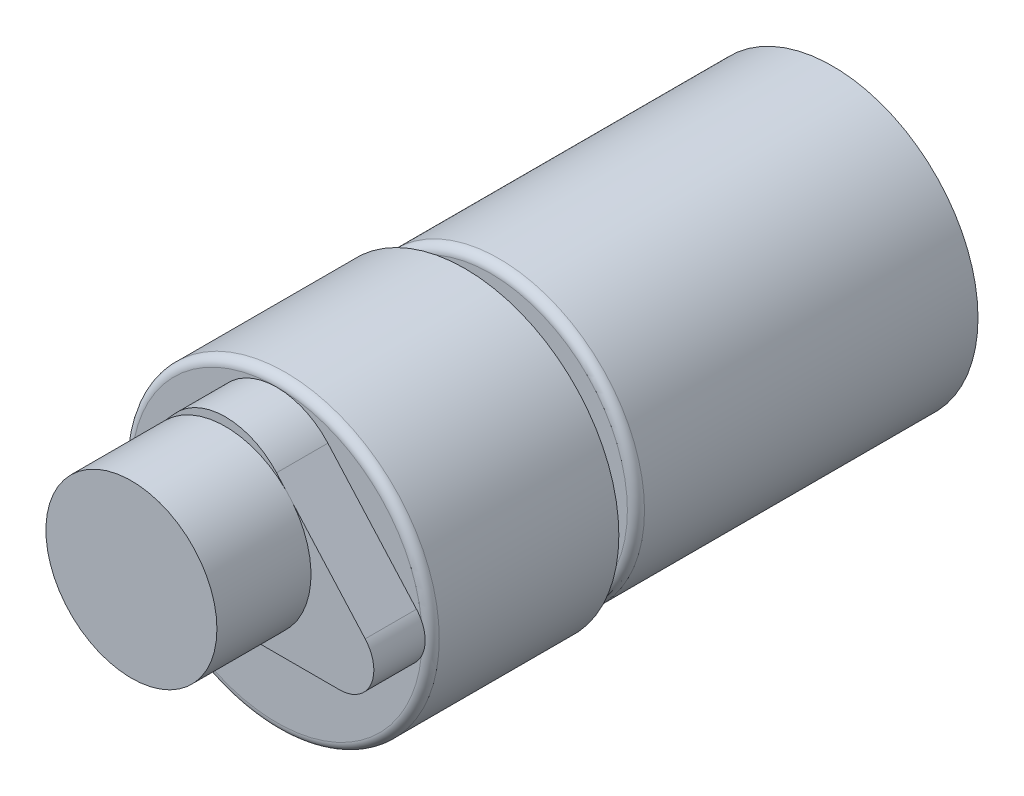
from build123d import *

# Parameters (mm, degrees)
ESQUISSE1_R        = 17
BOSS_EXTRU_1_DEPTH = 40
ESQUISSE2_R        = 5
BOSS_EXTRU_2_DEPTH = 3
CONG_1_R           = 1
ESQUISSE3_R        = 18
BOSS_EXTRU_3_DEPTH = 22
CONG_2_R           = 1
BOSS_EXTRU_4_DEPTH = 6
ESQUISSE5_R        = 10
BOSS_EXTRU_5_DEPTH = 11


with BuildPart() as part:
    # Esquisse1 → Boss.-Extru.1 (new body)
    with BuildSketch(Plane.XY):
        Circle(ESQUISSE1_R)
    extrude(amount=BOSS_EXTRU_1_DEPTH)

    # Esquisse2 → Boss.-Extru.2 (add)
    with BuildSketch(Plane.XY.offset(40)):
        Circle(ESQUISSE2_R)
    extrude(amount=BOSS_EXTRU_2_DEPTH)

    # Congé1
    cong_1_edges = [part.edges().sort_by_distance(p)[0] for p in [
        (-17, 0, 40),
    ]]
    fillet(cong_1_edges, radius=CONG_1_R)

    # Esquisse3 → Boss.-Extru.3 (add)
    with BuildSketch(Plane.XY.offset(43)):
        Circle(ESQUISSE3_R)
    extrude(amount=BOSS_EXTRU_3_DEPTH)

    # Congé2
    cong_2_edges = [part.edges().sort_by_distance(p)[0] for p in [
        (-18, 0, 65),
    ]]
    fillet(cong_2_edges, radius=CONG_2_R)

    # Esquisse4 → Boss.-Extru.4 (add)
    with BuildSketch(Plane.XY.offset(65)):
        with BuildLine():
            Line((-13.350159933, -4), (13.350159933, -4))
            ThreePointArc((13.350159933, -4), (17, -1.636663523), (16.336939985, 2.660666256))
            Line((16.336939985, 2.660666256), (5.973560103, 14.294269767))
            ThreePointArc((5.973560103, 14.294269767), (0, 16.972937256), (-5.973560103, 14.294269767))
            Line((-5.973560103, 14.294269767), (-16.336939985, 2.660666256))
            ThreePointArc((-16.336939985, 2.660666256), (-17, -1.636663523), (-13.350159933, -4))
        make_face()
    extrude(amount=BOSS_EXTRU_4_DEPTH)

    # Esquisse5 → Boss.-Extru.5 (add)
    with BuildSketch(Plane.XY.offset(71)):
        with Locations(Location((0, 6, 0), (0, 0, 142.149265436))):
            Circle(ESQUISSE5_R)
    extrude(amount=BOSS_EXTRU_5_DEPTH)


solid = part.part
